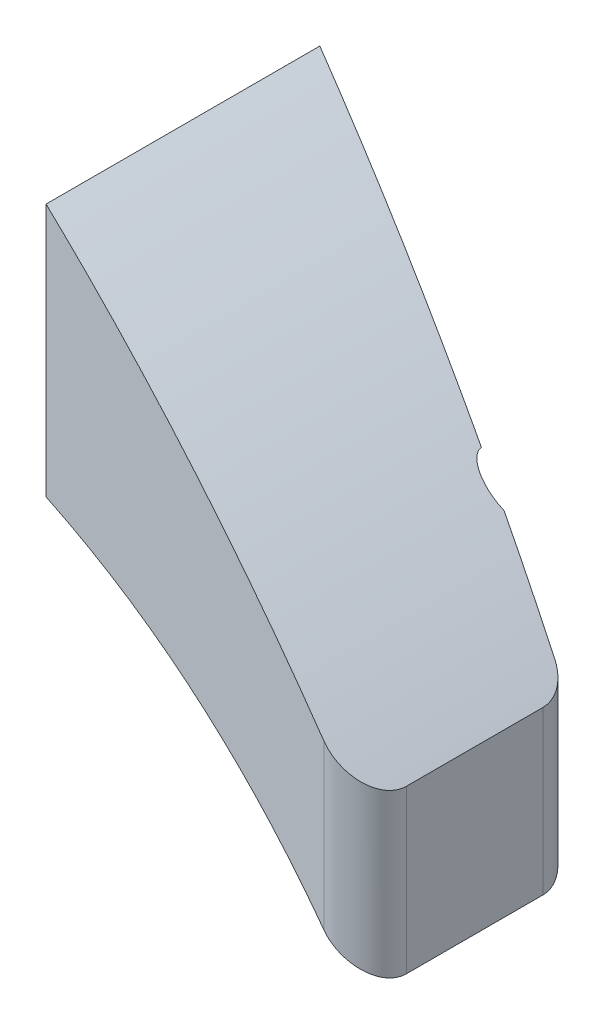
from build123d import *

# Parameters (mm, degrees)
BOSS_EXTRUDE1_DEPTH     = 100
CUT_EXTRUDE3_DEPTH      = 150
CUT_EXTRUDE3_DEPTH_BACK = 150
CUT_EXTRUDE6_DEPTH      = 150
CUT_EXTRUDE6_DEPTH_BACK = 150
FILLET7_R               = 8
SKETCH5_R               = 2.3
CUT_EXTRUDE7_DEPTH      = 5
SKETCH6_R               = 4.5
CUT_EXTRUDE8_DEPTH      = 150


with BuildPart() as part:
    # Sketch1 → Boss-Extrude1 (new body)
    with BuildSketch(Plane(origin=(0, 0, 0), x_dir=(0, 0, -1), z_dir=(1, 0, 0))):
        Polygon((-30, 27.8), (30, 27.8), (30, -27.8), (30, -57.8), (-62, -57.8), (-62, -27.8), (-62, 27.8), align=None)
    extrude(amount=BOSS_EXTRUDE1_DEPTH)

    # Sketch3 → Cut-Extrude3 (cut, two sides: drawn at the far end of the back side and taken through both)
    with BuildSketch(Plane(origin=(0, 0, 0), x_dir=(1, 0, 0), z_dir=(0, 1, 0)).offset(-CUT_EXTRUDE3_DEPTH_BACK)):
        Polygon((0, 30), (100, -16), (100, 30), align=None)
        Polygon((100, -62), (0, -62), (0, -30), align=None)
    extrude(amount=CUT_EXTRUDE3_DEPTH + CUT_EXTRUDE3_DEPTH_BACK, mode=Mode.SUBTRACT)

    # Sketch4 → Cut-Extrude6 (cut, two sides: drawn at the far end of the back side and taken through both)
    with BuildSketch(Plane.XY.offset(-CUT_EXTRUDE6_DEPTH_BACK)):
        with BuildLine():
            Line((100, 27.8), (0, 27.8))
            add(Edge.make_bspline(
                [(0, 27.8), (55.001263305, 9.951718706), (100, -22.2)],
                knots=[0, 0, 0, 0.534302679, 0.534302679, 0.534302679], degree=2))
            Line((100, -22.2), (100, 27.8))
        make_face()
        with BuildLine():
            Line((0, -27.8), (0, -57.8))
            Line((0, -57.8), (100, -57.8))
            add(Edge.make_bspline(
                [(0, -27.8), (59.172869478, -28.215423473), (100, -57.8)],
                knots=[0, 0, 0, 0.618763152, 0.618763152, 0.618763152], degree=2))
        make_face()
    extrude(amount=CUT_EXTRUDE6_DEPTH + CUT_EXTRUDE6_DEPTH_BACK, mode=Mode.SUBTRACT)

    # Fillet7
    fillet7_edges = [part.edges().sort_by_distance(p)[0] for p in [
        (100, -40, 62),
        (100, -40, 16),
    ]]
    fillet(fillet7_edges, radius=FILLET7_R)

    # Sketch5 → Cut-Extrude7 (cut)
    with BuildSketch(Plane.ZY):
        with Locations((0, -5)):
            Circle(SKETCH5_R)
        with Locations((0, -25)):
            Circle(SKETCH5_R)
    extrude(amount=-CUT_EXTRUDE7_DEPTH, mode=Mode.SUBTRACT)

    # Sketch6 → Cut-Extrude8 (cut)
    with BuildSketch(Plane.ZY.offset(-5)):
        with Locations((0, -5)):
            Circle(SKETCH6_R)
        with Locations(Location((0, -25, 0), (0, 0, 320.073904161))):
            Circle(SKETCH6_R)
    extrude(amount=-CUT_EXTRUDE8_DEPTH, mode=Mode.SUBTRACT)


solid = part.part
